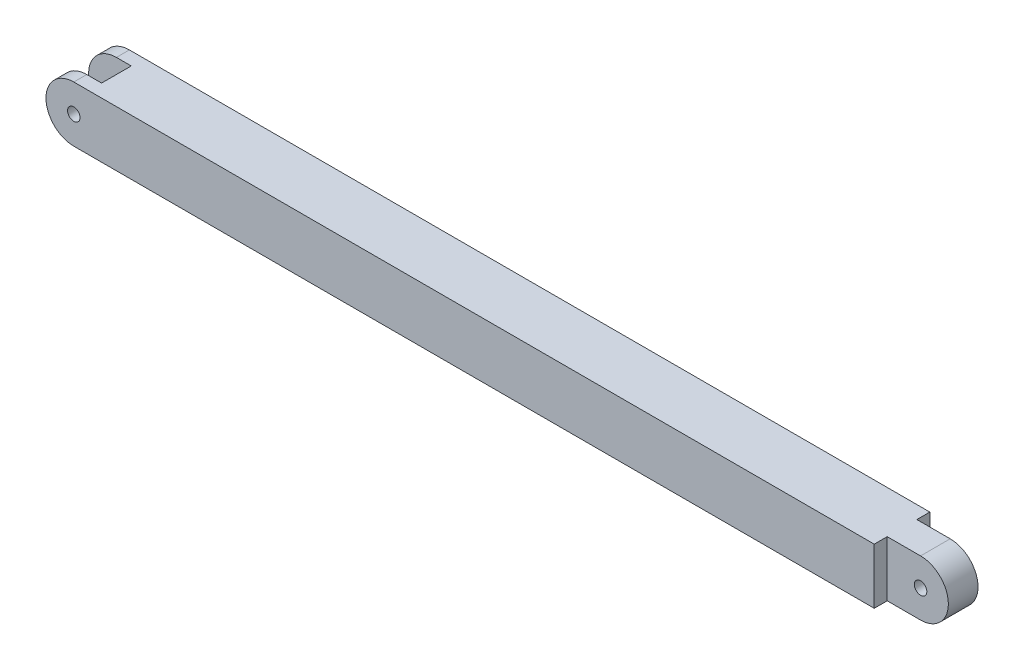
from build123d import *

# Parameters (mm, degrees)
BOSS_EXTRUDE1_DEPTH      = 15
H_0_266_DIAMETER_HOLE1_D = 6.7564
SKETCH5_W                = 40
SKETCH5_H                = 16
SKETCH5_H_2              = 20.916111238
CUT_EXTRUDE1_DEPTH       = 243.332416321


with BuildPart() as part:
    # Sketch1 → Boss-Extrude1 (new, symmetric)
    with BuildSketch(Plane.XY):
        with BuildLine():
            Line((-225, 15), (225, 15))
            ThreePointArc((225, 15), (240, 0), (225, -15))
            Line((225, -15), (-225, -15))
            ThreePointArc((-225, -15), (-240, 0), (-225, 15))
        make_face()
    extrude(amount=BOSS_EXTRUDE1_DEPTH, both=True)

    # H (0.266) Diameter Hole1 (through all)
    with Locations(Plane.XY.offset(15)):
        with Locations((-225, 0), (225, 0)):
            Hole(H_0_266_DIAMETER_HOLE1_D / 2)

    # Sketch5 → Cut-Extrude1 (cut, through all)
    with BuildSketch(Plane(origin=(0, 15, 0), x_dir=(1, 0, 0), z_dir=(0, 1, 0))):
        with Locations((-237, 0)):
            Rectangle(SKETCH5_W, SKETCH5_H)
        with Locations((227, 18.458055619)):
            Rectangle(SKETCH5_W, SKETCH5_H_2)
        with Locations((227, -18.458055619)):
            Rectangle(SKETCH5_W, SKETCH5_H_2)
    extrude(amount=-CUT_EXTRUDE1_DEPTH, mode=Mode.SUBTRACT)


solid = part.part
